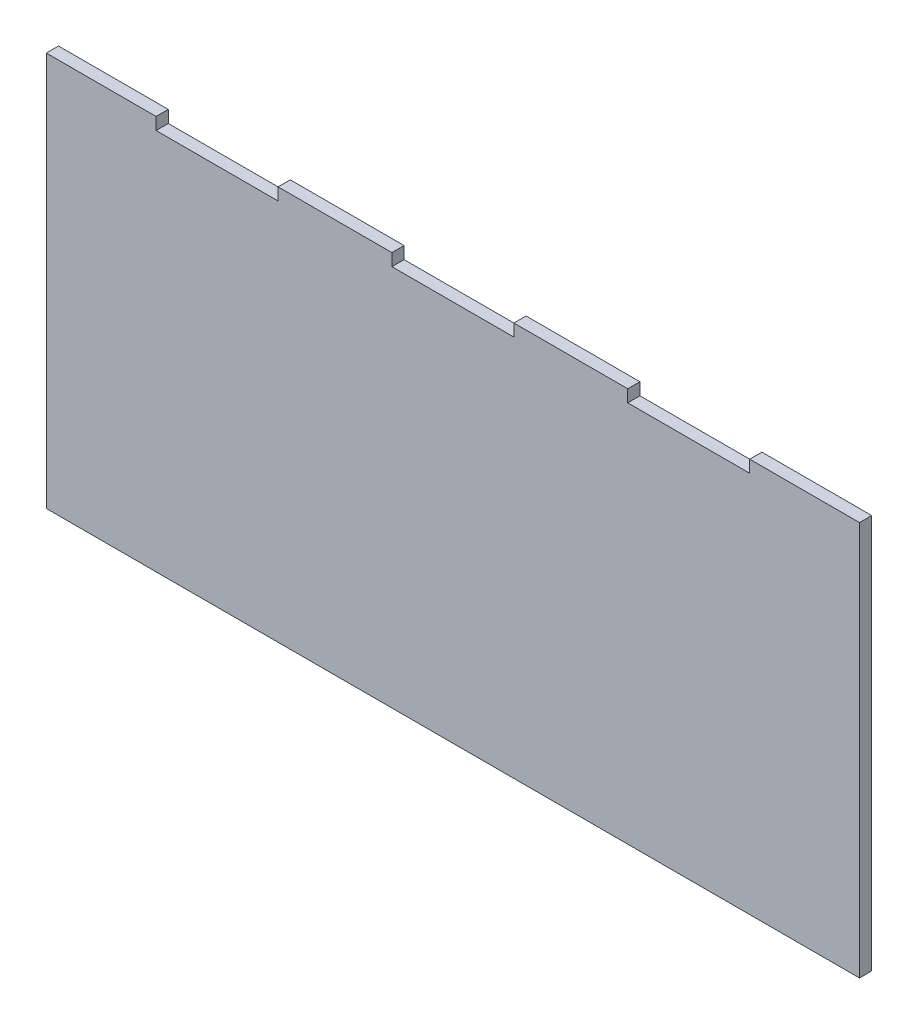
from build123d import *

# Parameters (mm, degrees)
EXTRUDE_1_DEPTH = 3


with BuildPart() as part:
    # 草圖1 → 填料-伸長1 (new body)
    with BuildSketch(Plane.XY):
        Polygon((-96, 139.070510231), (-69, 139.070510231), (-69, 136.070510231), (-39, 136.070510231), (-39, 139.070510231), (-11, 139.070510231), (-11, 136.070510231), (19, 136.070510231), (19, 139.070510231), (47, 139.070510231), (47, 136.070510231), (77, 136.070510231), (77, 139.070510231), (104, 139.070510231), (104, 42.070510231), (-96, 42.070510231), align=None)
    extrude(amount=EXTRUDE_1_DEPTH)


solid = part.part
